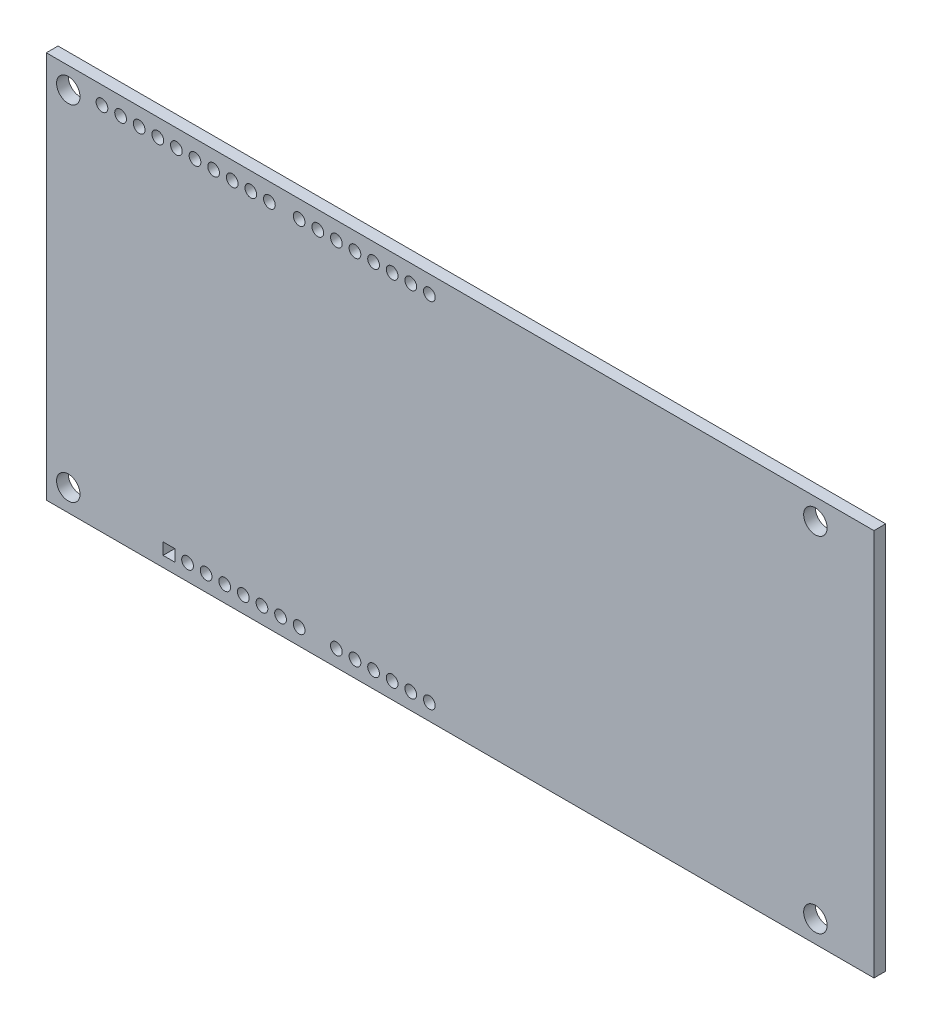
from build123d import *

# Parameters (mm, degrees)
MODEL_W            = 113
MODEL_H            = 52.9
MODEL_R            = 0.8
MODEL_R_2          = 1.59995
MODEL_W_2          = 1.6
MODEL_H_2          = 1.6
BOSS_EXTRU_1_DEPTH = 1.6


with BuildPart() as part:
    # Model → Boss.-Extru.1 (new body)
    with BuildSketch(Plane.XY):
        with Locations((56.5, 26.45)):
            Rectangle(MODEL_W, MODEL_H)
        with Locations((52.3, 50.5)):
            Circle(MODEL_R, mode=Mode.SUBTRACT)
        with Locations((49.76, 50.5)):
            Circle(MODEL_R, mode=Mode.SUBTRACT)
        with Locations((47.22, 50.5)):
            Circle(MODEL_R, mode=Mode.SUBTRACT)
        with Locations((44.68, 50.5)):
            Circle(MODEL_R, mode=Mode.SUBTRACT)
        with Locations((42.14, 50.5)):
            Circle(MODEL_R, mode=Mode.SUBTRACT)
        with Locations((39.6, 50.5)):
            Circle(MODEL_R, mode=Mode.SUBTRACT)
        with Locations((37.06, 50.5)):
            Circle(MODEL_R, mode=Mode.SUBTRACT)
        with Locations((34.52, 50.5)):
            Circle(MODEL_R, mode=Mode.SUBTRACT)
        with Locations((30.46, 50.5)):
            Circle(MODEL_R, mode=Mode.SUBTRACT)
        with Locations((27.92, 50.5)):
            Circle(MODEL_R, mode=Mode.SUBTRACT)
        with Locations((25.38, 50.5)):
            Circle(MODEL_R, mode=Mode.SUBTRACT)
        with Locations((22.84, 50.5)):
            Circle(MODEL_R, mode=Mode.SUBTRACT)
        with Locations((20.3, 50.5)):
            Circle(MODEL_R, mode=Mode.SUBTRACT)
        with Locations((17.76, 50.5)):
            Circle(MODEL_R, mode=Mode.SUBTRACT)
        with Locations((15.22, 50.5)):
            Circle(MODEL_R, mode=Mode.SUBTRACT)
        with Locations((12.68, 50.5)):
            Circle(MODEL_R, mode=Mode.SUBTRACT)
        with Locations((10.14, 50.5)):
            Circle(MODEL_R, mode=Mode.SUBTRACT)
        with Locations((7.6, 50.5)):
            Circle(MODEL_R, mode=Mode.SUBTRACT)
        with Locations((19.28, 2.24)):
            Circle(MODEL_R, mode=Mode.SUBTRACT)
        with Locations((21.82, 2.24)):
            Circle(MODEL_R, mode=Mode.SUBTRACT)
        with Locations((24.36, 2.24)):
            Circle(MODEL_R, mode=Mode.SUBTRACT)
        with Locations((26.9, 2.24)):
            Circle(MODEL_R, mode=Mode.SUBTRACT)
        with Locations((29.44, 2.24)):
            Circle(MODEL_R, mode=Mode.SUBTRACT)
        with Locations((31.98, 2.24)):
            Circle(MODEL_R, mode=Mode.SUBTRACT)
        with Locations((34.52, 2.24)):
            Circle(MODEL_R, mode=Mode.SUBTRACT)
        with Locations((39.6, 2.24)):
            Circle(MODEL_R, mode=Mode.SUBTRACT)
        with Locations((42.14, 2.24)):
            Circle(MODEL_R, mode=Mode.SUBTRACT)
        with Locations((44.68, 2.24)):
            Circle(MODEL_R, mode=Mode.SUBTRACT)
        with Locations((47.22, 2.24)):
            Circle(MODEL_R, mode=Mode.SUBTRACT)
        with Locations((49.76, 2.24)):
            Circle(MODEL_R, mode=Mode.SUBTRACT)
        with Locations((52.3, 2.24)):
            Circle(MODEL_R, mode=Mode.SUBTRACT)
        with Locations((105, 3)):
            Circle(MODEL_R_2, mode=Mode.SUBTRACT)
        with Locations((105, 50)):
            Circle(MODEL_R_2, mode=Mode.SUBTRACT)
        with Locations((3, 50)):
            Circle(MODEL_R_2, mode=Mode.SUBTRACT)
        with Locations((3, 3)):
            Circle(MODEL_R_2, mode=Mode.SUBTRACT)
        with Locations((16.74, 2.24)):
            Rectangle(MODEL_W_2, MODEL_H_2, mode=Mode.SUBTRACT)
    extrude(amount=BOSS_EXTRU_1_DEPTH)


solid = part.part
